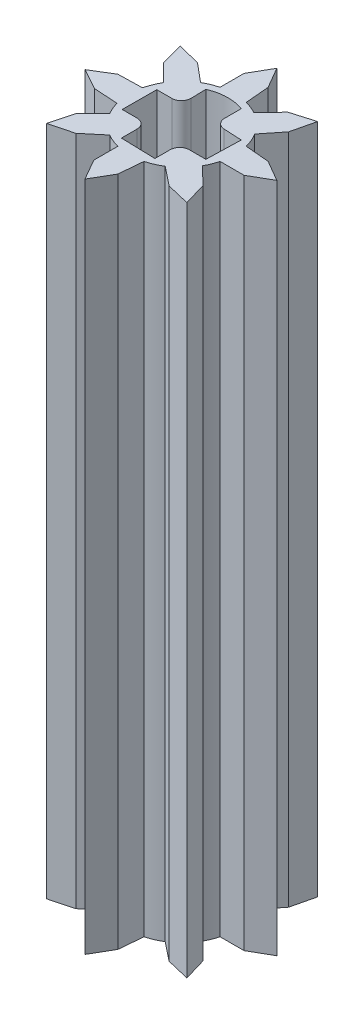
from build123d import *

# Parameters (mm, degrees)
BOSS_EXTRUDE2_DEPTH = 35
FILLET1_R           = 0.5


with BuildPart() as part:
    # Sketch1 → Boss-Extrude2 (new body)
    # profile 1 of 16: a face of its own
    with BuildSketch(Plane(origin=(0, 0, 0), x_dir=(1, 0, 0), z_dir=(0, 1, 0))):
        with BuildLine():
            Line((-0.682874368, 2.6638661), (-0.958491781, 2.577555723))
            ThreePointArc((-0.958491781, 2.577555723), (-1.18434287, 2.481900878), (-1.400772687, 2.36650288))
            ThreePointArc((-1.400772687, 2.36650288), (-1.944543648, 1.944543648), (-2.36650288, 1.400772687))
            ThreePointArc((-2.36650288, 1.400772687), (-2.55302024, 1.02205071), (-2.679372725, 0.619242926))
            ThreePointArc((-2.679372725, 0.619242926), (-2.749220106, -0.065488988), (-2.646848542, -0.746118487))
            ThreePointArc((-2.646848542, -0.746118487), (-2.527956912, -1.082558936), (-2.36650288, -1.400772687))
            ThreePointArc((-2.36650288, -1.400772687), (-1.944543648, -1.944543648), (-1.400772687, -2.36650288))
            ThreePointArc((-1.400772687, -2.36650288), (-1.052379439, -2.540668714), (-0.682874368, -2.6638661))
            ThreePointArc((-0.682874368, -2.6638661), (0, -2.75), (0.682874368, -2.6638661))
            ThreePointArc((0.682874368, -2.6638661), (1.082558936, -2.527956912), (1.456731751, -2.332473495))
            ThreePointArc((1.456731751, -2.332473495), (1.990299888, -1.897684472), (2.399189994, -1.344019111))
            ThreePointArc((2.399189994, -1.344019111), (2.55302024, -1.02205071), (2.6638661, -0.682874368))
            ThreePointArc((2.6638661, -0.682874368), (2.728381551, -0.344142576), (2.75, 0))
            ThreePointArc((2.75, 0), (2.728381551, 0.344142576), (2.6638661, 0.682874368))
            ThreePointArc((2.6638661, 0.682874368), (2.527956912, 1.082558936), (2.332473495, 1.456731751))
            ThreePointArc((2.332473495, 1.456731751), (1.897684472, 1.990299888), (1.344019111, 2.399189994))
            ThreePointArc((1.344019111, 2.399189994), (1.02205071, 2.55302024), (0.682874368, 2.6638661))
            ThreePointArc((0.682874368, 2.6638661), (0, 2.75), (-0.682874368, 2.6638661))
        make_face()
        with BuildLine():
            ThreePointArc((-0.958491781, 2.200293959), (-0.065885125, 2.399095486), (0.836287098, 2.249583048))
            ThreePointArc((0.836287098, 2.249583048), (1.697056275, 1.697056275), (2.249583048, 0.836287098))
            ThreePointArc((2.249583048, 0.836287098), (2.362096454, 0.424853319), (2.4, 0))
            ThreePointArc((2.4, 0), (2.349543094, -0.489537791), (2.200293959, -0.958491781))
            ThreePointArc((2.200293959, -0.958491781), (1.649828868, -1.743004505), (0.836287098, -2.249583048))
            ThreePointArc((0.836287098, -2.249583048), (-0.065885125, -2.399095486), (-0.958491781, -2.200293959))
            ThreePointArc((-0.958491781, -2.200293959), (-1.723234871, -1.670467473), (-2.229029582, -0.889621899))
            ThreePointArc((-2.229029582, -0.889621899), (-2.399984108, 0.008733954), (-2.222495654, 0.905821764))
            ThreePointArc((-2.222495654, 0.905821764), (-1.717144383, 1.676727518), (-0.958491781, 2.200293959))
        make_face(mode=Mode.SUBTRACT)
    # profile 2 of 16: a face of its own
    with BuildSketch(Plane(origin=(0, 0, 0), x_dir=(1, 0, 0), z_dir=(0, 1, 0))):
        with BuildLine():
            Line((-0.927656245, 0.905821764), (-0.958491781, 2.200293959))
            ThreePointArc((-0.958491781, 2.200293959), (-1.717144383, 1.676727518), (-2.222495654, 0.905821764))
            Line((-2.222495654, 0.905821764), (-0.927656245, 0.905821764))
        make_face()
    # profile 3 of 16: a face of its own
    with BuildSketch(Plane(origin=(0, 0, 0), x_dir=(1, 0, 0), z_dir=(0, 1, 0))):
        with BuildLine():
            Line((-2.229029582, -0.889621899), (-2.222495654, 0.905821764))
            ThreePointArc((-2.222495654, 0.905821764), (-2.399984108, 0.008733954), (-2.229029582, -0.889621899))
        make_face()
    # profile 4 of 16: a face of its own
    with BuildSketch(Plane(origin=(0, 0, 0), x_dir=(1, 0, 0), z_dir=(0, 1, 0))):
        with BuildLine():
            Line((-0.958491781, -0.889621899), (-2.229029582, -0.889621899))
            ThreePointArc((-2.229029582, -0.889621899), (-1.723234871, -1.670467473), (-0.958491781, -2.200293959))
            Line((-0.958491781, -2.200293959), (-0.958491781, -0.889621899))
        make_face()
    # profile 5 of 16: a face of its own
    with BuildSketch(Plane(origin=(0, 0, 0), x_dir=(1, 0, 0), z_dir=(0, 1, 0))):
        with BuildLine():
            ThreePointArc((-0.958491781, -2.200293959), (-0.065885125, -2.399095486), (0.836287098, -2.249583048))
            Line((0.836287098, -2.249583048), (-0.958491781, -2.200293959))
        make_face()
    # profile 6 of 16: a face of its own
    with BuildSketch(Plane(origin=(0, 0, 0), x_dir=(1, 0, 0), z_dir=(0, 1, 0))):
        with BuildLine():
            ThreePointArc((0.836287098, -2.249583048), (1.649828868, -1.743004505), (2.200293959, -0.958491781))
            Line((2.200293959, -0.958491781), (0.836287098, -0.958491781))
            Line((0.836287098, -0.958491781), (0.836287098, -2.249583048))
        make_face()
    # profile 7 of 16: a face of its own
    with BuildSketch(Plane(origin=(0, 0, 0), x_dir=(1, 0, 0), z_dir=(0, 1, 0))):
        with BuildLine():
            ThreePointArc((2.4, 0), (2.362096454, 0.424853319), (2.249583048, 0.836287098))
            Line((2.249583048, 0.836287098), (2.200293959, -0.958491781))
            ThreePointArc((2.200293959, -0.958491781), (2.349543094, -0.489537791), (2.4, 0))
        make_face()
    # profile 8 of 16: a face of its own
    with BuildSketch(Plane(origin=(0, 0, 0), x_dir=(1, 0, 0), z_dir=(0, 1, 0))):
        with BuildLine():
            ThreePointArc((2.249583048, 0.836287098), (1.697056275, 1.697056275), (0.836287098, 2.249583048))
            Line((0.836287098, 2.249583048), (0.836287098, 0.905821764))
            Line((0.836287098, 0.905821764), (2.249583048, 0.836287098))
        make_face()
    # profile 9 of 16: a face of its own
    with BuildSketch(Plane(origin=(0, 0, 0), x_dir=(1, 0, 0), z_dir=(0, 1, 0))):
        with BuildLine():
            ThreePointArc((-2.646848542, -0.746118487), (-2.749220106, -0.065488988), (-2.679372725, 0.619242926))
            Line((-2.679372725, 0.619242926), (-3.931143789, 0.589424572))
            Line((-3.931143789, 0.589424572), (-5, -0.059543887))
            Line((-5, -0.059543887), (-3.901275064, -0.664461024))
            Line((-3.901275064, -0.664461024), (-2.646848542, -0.746118487))
        make_face()
    # profile 10 of 16: a face of its own
    with BuildSketch(Plane(origin=(0, 0, 0), x_dir=(1, 0, 0), z_dir=(0, 1, 0))):
        with BuildLine():
            ThreePointArc((-1.400772687, -2.36650288), (-1.944543648, -1.944543648), (-2.36650288, -1.400772687))
            Line((-2.36650288, -1.400772687), (-3.251889781, -2.286159588))
            Line((-3.251889781, -2.286159588), (-3.577637792, -3.49343002))
            Line((-3.577637792, -3.49343002), (-2.365007256, -3.173042114))
            Line((-2.365007256, -3.173042114), (-1.400772687, -2.36650288))
        make_face()
    # profile 11 of 16: a face of its own
    with BuildSketch(Plane(origin=(0, 0, 0), x_dir=(1, 0, 0), z_dir=(0, 1, 0))):
        with BuildLine():
            ThreePointArc((0.682874368, -2.6638661), (0, -2.75), (-0.682874368, -2.6638661))
            Line((-0.682874368, -2.6638661), (-0.682874368, -3.915992264))
            Line((-0.682874368, -3.915992264), (-0.059543887, -5))
            Line((-0.059543887, -5), (0.571366928, -3.915992264))
            Line((0.571366928, -3.915992264), (0.682874368, -2.6638661))
        make_face()
    # profile 12 of 16: a face of its own
    with BuildSketch(Plane(origin=(0, 0, 0), x_dir=(1, 0, 0), z_dir=(0, 1, 0))):
        with BuildLine():
            Line((3.305410563, -2.208070158), (2.399189994, -1.344019111))
            ThreePointArc((2.399189994, -1.344019111), (1.990299888, -1.897684472), (1.456731751, -2.332473495))
            Line((1.456731751, -2.332473495), (2.439899933, -3.115821544))
            Line((2.439899933, -3.115821544), (3.659816345, -3.407240789))
            Line((3.659816345, -3.407240789), (3.305410563, -2.208070158))
        make_face()
    # profile 13 of 16: a face of its own
    with BuildSketch(Plane(origin=(0, 0, 0), x_dir=(1, 0, 0), z_dir=(0, 1, 0))):
        with BuildLine():
            Line((3.915992264, 0.571366928), (2.6638661, 0.682874368))
            ThreePointArc((2.6638661, 0.682874368), (2.728381551, 0.344142576), (2.75, 0))
            ThreePointArc((2.75, 0), (2.728381551, -0.344142576), (2.6638661, -0.682874368))
            Line((2.6638661, -0.682874368), (3.915992264, -0.682874368))
            Line((3.915992264, -0.682874368), (5, -0.059543887))
            Line((5, -0.059543887), (3.915992264, 0.571366928))
        make_face()
    # profile 14 of 16: a face of its own
    with BuildSketch(Plane(origin=(0, 0, 0), x_dir=(1, 0, 0), z_dir=(0, 1, 0))):
        with BuildLine():
            Line((2.208070158, 3.305410563), (1.344019111, 2.399189994))
            ThreePointArc((1.344019111, 2.399189994), (1.897684472, 1.990299888), (2.332473495, 1.456731751))
            Line((2.332473495, 1.456731751), (3.115821544, 2.439899933))
            Line((3.115821544, 2.439899933), (3.407240789, 3.659816345))
            Line((3.407240789, 3.659816345), (2.208070158, 3.305410563))
        make_face()
    # profile 15 of 16: a face of its own
    with BuildSketch(Plane(origin=(0, 0, 0), x_dir=(1, 0, 0), z_dir=(0, 1, 0))):
        with BuildLine():
            Line((-0.682874368, 3.915992264), (-0.682874368, 2.6638661))
            ThreePointArc((-0.682874368, 2.6638661), (0, 2.75), (0.682874368, 2.6638661))
            Line((0.682874368, 2.6638661), (0.571366928, 3.915992264))
            Line((0.571366928, 3.915992264), (-0.059543887, 5))
            Line((-0.059543887, 5), (-0.682874368, 3.915992264))
        make_face()
    # profile 16 of 16: a face of its own
    with BuildSketch(Plane(origin=(0, 0, 0), x_dir=(1, 0, 0), z_dir=(0, 1, 0))):
        with BuildLine():
            ThreePointArc((-2.36650288, 1.400772687), (-1.944543648, 1.944543648), (-1.400772687, 2.36650288))
            Line((-1.400772687, 2.36650288), (-2.365007256, 3.173042114))
            Line((-2.365007256, 3.173042114), (-3.577637792, 3.49343002))
            Line((-3.577637792, 3.49343002), (-3.251889781, 2.286159588))
            Line((-3.251889781, 2.286159588), (-2.36650288, 1.400772687))
        make_face()
    extrude(amount=BOSS_EXTRUDE2_DEPTH)

    # Fillet1
    fillet1_edges = [part.edges().sort_by_distance(p)[0] for p in [
        (0.836287098, 17.5, -0.905821764),
        (-0.927656245, 17.5, -0.905821764),
        (-0.958491781, 17.5, 0.889621899),
        (0.836287098, 17.5, 0.958491781),
    ]]
    fillet(fillet1_edges, radius=FILLET1_R)


solid = part.part
